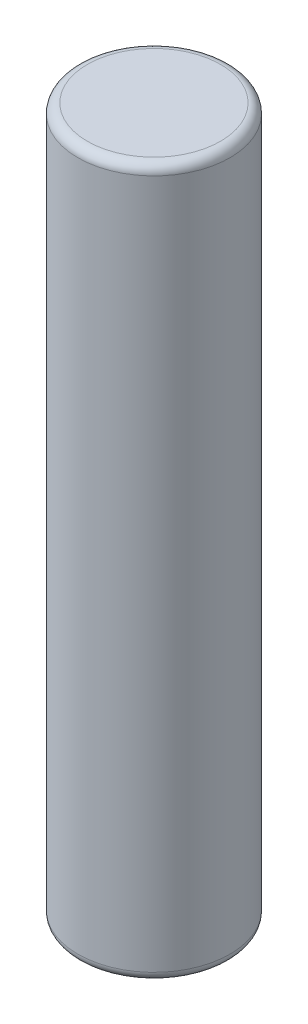
from build123d import *

# Parameters (mm, degrees)
SKETCH1_R           = 4
BOSS_EXTRUDE1_DEPTH = 37.25
FILLET1_R           = 0.5


with BuildPart() as part:
    # Sketch1 → Boss-Extrude1 (new body)
    with BuildSketch(Plane(origin=(0, 0, 0), x_dir=(1, 0, 0), z_dir=(0, 1, 0))):
        with Locations(Location((0, 0, 0), (0, 0, 270))):
            Circle(SKETCH1_R)
    extrude(amount=BOSS_EXTRUDE1_DEPTH)

    # Fillet1
    fillet1_edges = [part.edges().sort_by_distance(p)[0] for p in [
        (0, 0, -4),
        (0, 37.25, -4),
    ]]
    fillet(fillet1_edges, radius=FILLET1_R)


solid = part.part
